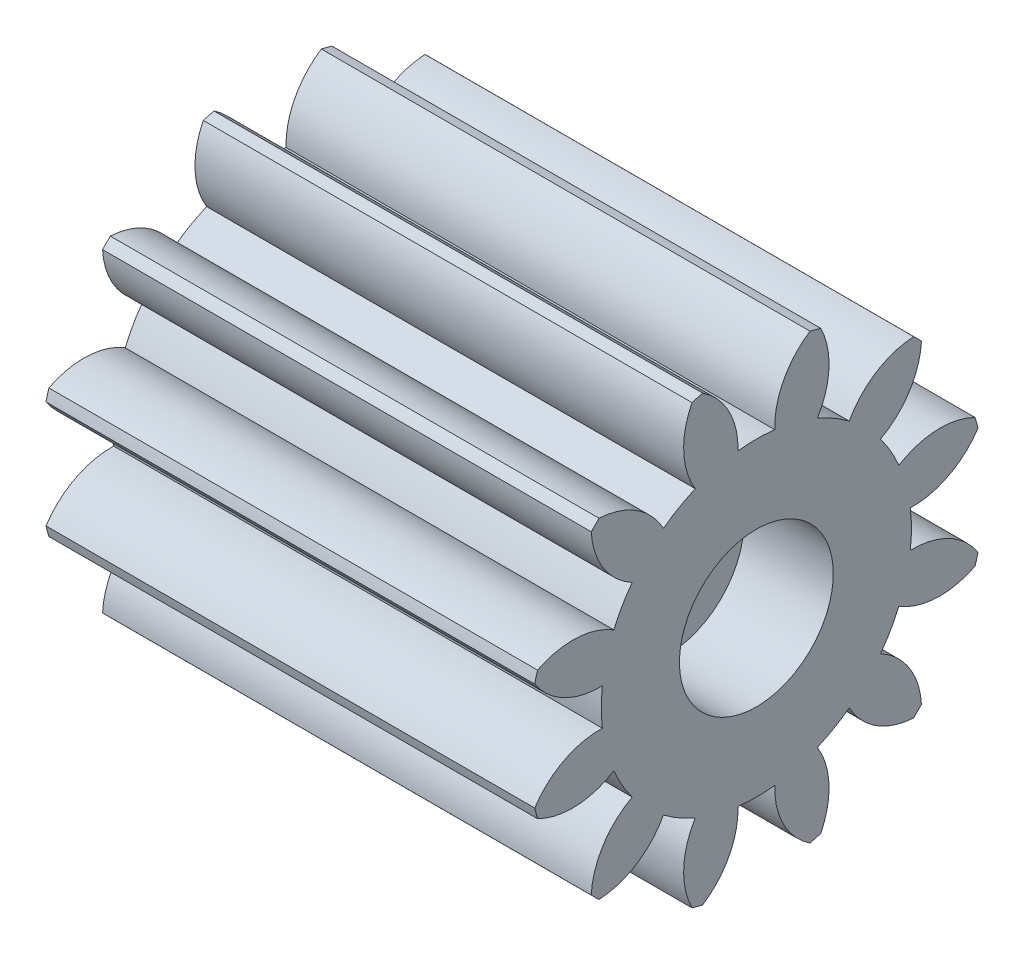
from build123d import *

# Parameters (mm, degrees)
BASPROSKE_W          = 19.05
BASPROSKE_H          = 8.89
TOOTHCUT_DEPTH       = 23.82469496
TEETHCUTS_COUNT      = 12
TEETHCUTS_ANGLE      = 330
BORSKE_R             = 1.5875
BORE_DEPTH           = 50.8015748
CUT_EXTRUDE1_START   = -19.05
SKETCH1_R            = 3
CUT_EXTRUDE1_DEPTH   = 3.4798
M3_CLEARANCE_HOLE1_D = 3.4


with BuildPart() as part:
    # BasProSke → Base-Revolve (revolve)
    with BuildSketch(Plane(origin=(0, 0, 0), x_dir=(1, 0, 0), z_dir=(0, 1, 0)), mode=Mode.PRIVATE) as base_revolve_sk:
        with Locations((9.525, 4.445)):
            Rectangle(BASPROSKE_W, BASPROSKE_H)
    revolve(base_revolve_sk.sketch.rotate(Axis((-10, 0, 0), (1, 0, 0)), 180), axis=Axis((-10, 0, 0), (1, 0, 0)))

    # TooCutSke → ToothCut (cut, through all)
    with BuildSketch(Plane(origin=(0, 0, 0), x_dir=(0, 0, -1), z_dir=(1, 0, 0))):
        with BuildLine():
            ThreePointArc((0.717076553, 6.002519826), (0, 6.0452), (-0.717076553, 6.002519826))
            ThreePointArc((-0.717076553, 6.002519826), (-1.069160545, 7.516029346), (-2.121611652, 8.659279483))
            ThreePointArc((-2.121611652, 8.659279483), (0, 8.9154), (2.121611652, 8.659279483))
            ThreePointArc((2.121611652, 8.659279483), (1.069160545, 7.516029346), (0.717076553, 6.002519826))
        make_face()
    toothcut = extrude(amount=TOOTHCUT_DEPTH, mode=Mode.SUBTRACT)

    # TeethCuts: ToothCut ×12 about axis
    teethcuts_axis = Axis((-10, 0, 0), (1, 0, 0))
    for i in range(1, TEETHCUTS_COUNT):
        add(toothcut.rotate(teethcuts_axis, i * TEETHCUTS_ANGLE / (TEETHCUTS_COUNT - 1)), mode=Mode.SUBTRACT)

    # BorSke → Bore (cut, symmetric)
    with BuildSketch(Plane(origin=(0, 0, 0), x_dir=(0, 0, -1), z_dir=(1, 0, 0))):
        with Locations(Location((0, 0, 0), (0, 0, 180))):
            Circle(BORSKE_R)
    extrude(amount=BORE_DEPTH, both=True, mode=Mode.SUBTRACT)

    # Sketch1 → Cut-Extrude1 (cut)
    with BuildSketch(Plane.ZY.offset(CUT_EXTRUDE1_START)):
        Circle(SKETCH1_R)
    extrude(amount=CUT_EXTRUDE1_DEPTH, mode=Mode.SUBTRACT)

    # M3 Clearance Hole1 (through all)
    with Locations(Plane(origin=(0, 0, 0), x_dir=(0, 0, -1), z_dir=(-1, 0, 0))):
        with Locations((0, 0)):
            Hole(M3_CLEARANCE_HOLE1_D / 2)


solid = part.part
